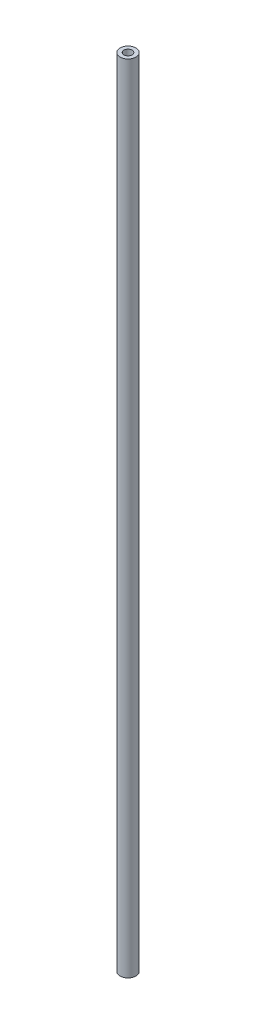
from build123d import *

# Parameters (mm, degrees)
SKETCH1_R           = 5
BOSS_EXTRUDE1_DEPTH = 500
SKETCH2_R           = 2.6
CUT_EXTRUDE1_DEPTH  = 10
CUT_EXTRUDE2_START  = -10
SKETCH3_R           = 2.6
CUT_EXTRUDE2_DEPTH  = 10


with BuildPart() as part:
    # Sketch1 → Boss-Extrude1 (new body)
    with BuildSketch(Plane(origin=(0, 0, 0), x_dir=(1, 0, 0), z_dir=(0, 1, 0))):
        with Locations(Location((0, 0, 0), (0, 0, 270))):
            Circle(SKETCH1_R)
    extrude(amount=BOSS_EXTRUDE1_DEPTH)

    # Sketch2 → Cut-Extrude1 (cut)
    with BuildSketch(Plane.XZ):
        with Locations(Location((0, 0, 0), (0, 0, 270))):
            Circle(SKETCH2_R)
    extrude(amount=-CUT_EXTRUDE1_DEPTH, mode=Mode.SUBTRACT)

    # Sketch3 → Cut-Extrude2 (cut)
    with BuildSketch(Plane(origin=(0, 500, 0), x_dir=(1, 0, 0), z_dir=(0, 1, 0)).offset(CUT_EXTRUDE2_START)):
        with Locations(Location((0, 0, 0), (0, 0, 90))):
            Circle(SKETCH3_R)
    extrude(amount=CUT_EXTRUDE2_DEPTH, mode=Mode.SUBTRACT)


solid = part.part
